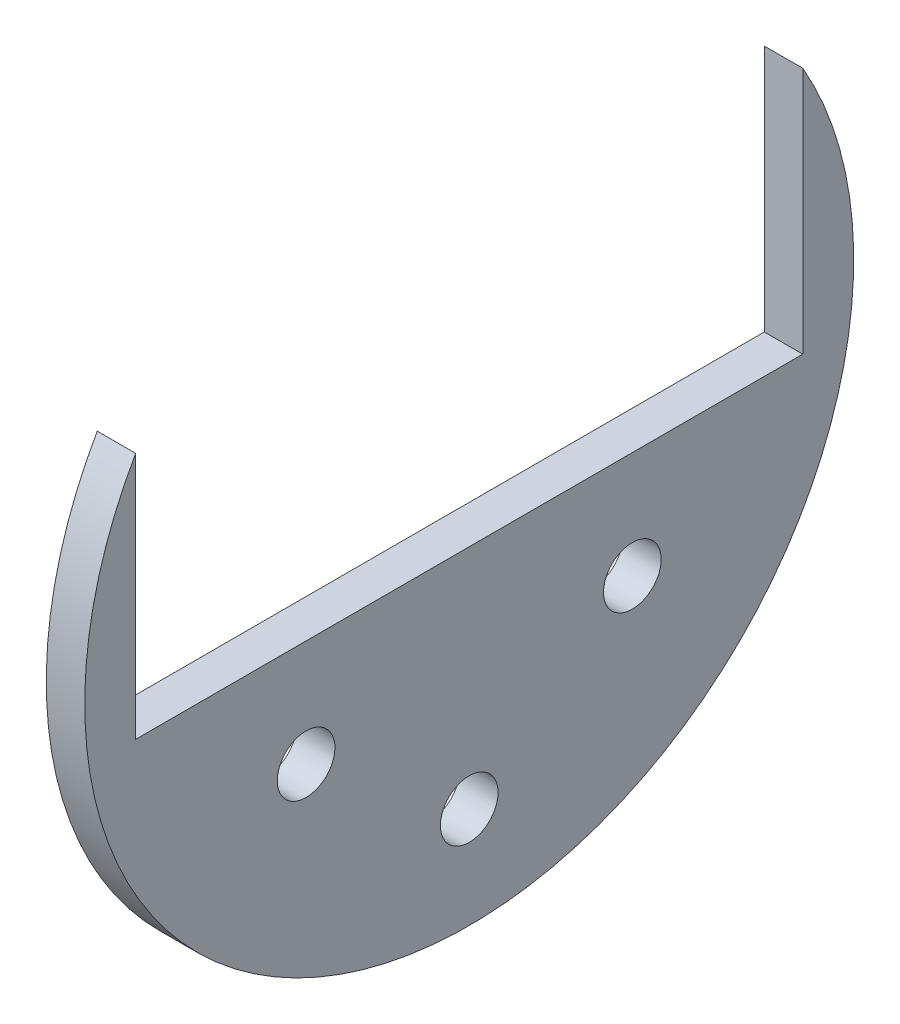
from build123d import *

# Parameters (mm, degrees)
SKETCH1_R           = 20
SKETCH1_R_2         = 1.5
BOSS_EXTRUDE1_DEPTH = 2
SKETCH3_W           = 34.7
SKETCH3_H           = 20.283452378
CUT_EXTRUDE1_DEPTH  = 29.354893758


with BuildPart() as part:
    # Sketch1 → Boss-Extrude1 (new body)
    with BuildSketch(Plane(origin=(0, 0, 0), x_dir=(0, 0, -1), z_dir=(1, 0, 0))):
        Circle(SKETCH1_R)
        with Locations((0, 14.75)):
            Circle(SKETCH1_R_2, mode=Mode.SUBTRACT)
        with Locations((14.75, 0)):
            Circle(SKETCH1_R_2, mode=Mode.SUBTRACT)
        with Locations((0, -14.75)):
            Circle(SKETCH1_R_2, mode=Mode.SUBTRACT)
        with Locations((-14.75, 0)):
            Circle(SKETCH1_R_2, mode=Mode.SUBTRACT)
        with Locations((-8.485281374, 8.485281374)):
            Circle(SKETCH1_R_2, mode=Mode.SUBTRACT)
        with Locations((8.485281374, 8.485281374)):
            Circle(SKETCH1_R_2, mode=Mode.SUBTRACT)
        with Locations((8.485281374, -8.485281374)):
            Circle(SKETCH1_R_2, mode=Mode.SUBTRACT)
        with Locations((-8.485281374, -8.485281374)):
            Circle(SKETCH1_R_2, mode=Mode.SUBTRACT)
    extrude(amount=BOSS_EXTRUDE1_DEPTH)

    # Sketch3 → Cut-Extrude1 (cut, through all)
    with BuildSketch(Plane(origin=(2, 0, 0), x_dir=(0, 0, -1), z_dir=(1, 0, 0))):
        with Locations((0, 7.208273811)):
            Rectangle(SKETCH3_W, SKETCH3_H)
    extrude(amount=-CUT_EXTRUDE1_DEPTH, mode=Mode.SUBTRACT)


with BuildPart() as cut_extrude1_kept_piece:
    # of the separate pieces the step leaves, the one the design keeps (cut_extrude1_pieces_kept)
    add(part.part.solids().sort_by_distance((0, 9.948743639, 17.35))[0])


solid = cut_extrude1_kept_piece.part
